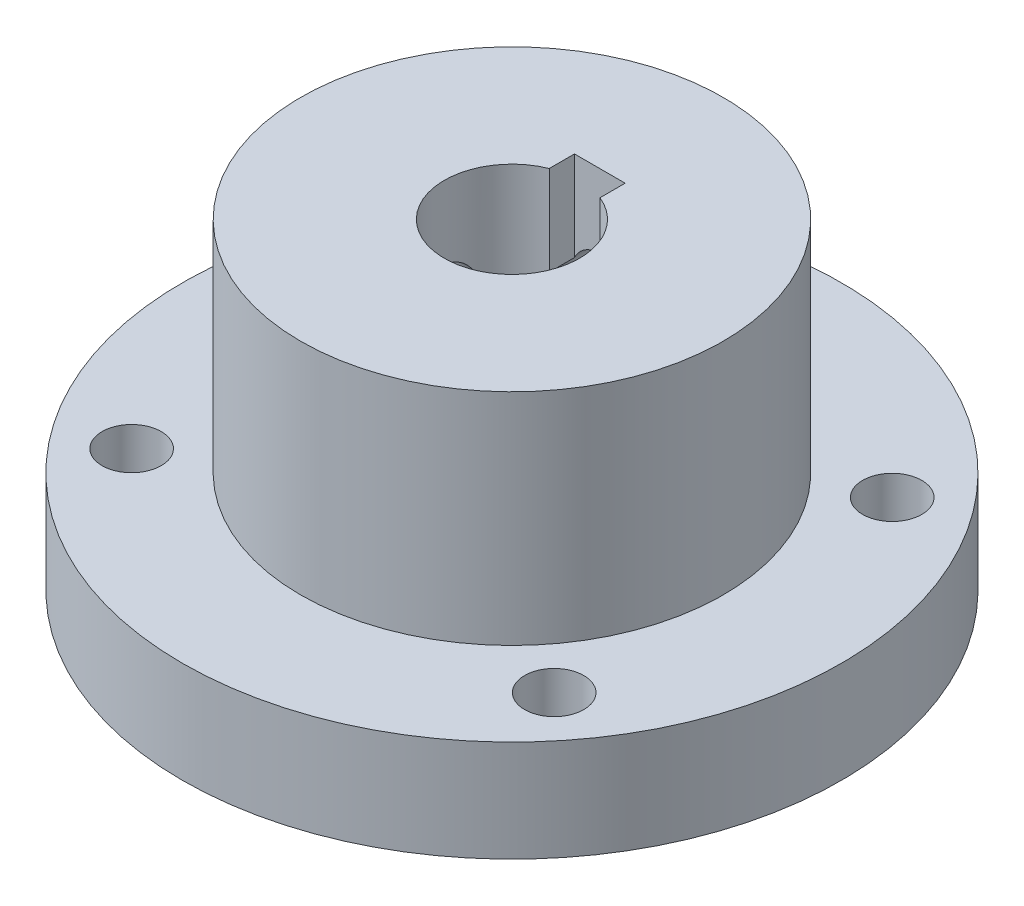
from build123d import *

# Parameters (mm, degrees)
SKETCH1_R           = 4
SKETCH1_R_2         = 1.75
BOSS_EXTRUDE1_DEPTH = 6
SKETCH2_R           = 12.5
SKETCH2_R_2         = 4
BOSS_EXTRUDE2_DEPTH = 13
SKETCH4_W           = 3
SKETCH4_H           = 2.4
CUT_EXTRUDE2_DEPTH  = 30
SKETCH3_R           = 1.65
CUT_EXTRUDE3_DEPTH  = 14
SKETCH5_R           = 1.65
CUT_EXTRUDE4_DEPTH  = 30
BOSS_EXTRUDE3_START = -6
BOSS_EXTRUDE3_DEPTH = 6


with BuildPart() as part:
    # Sketch1 → Boss-Extrude1 (new body)
    with BuildSketch(Plane(origin=(0, 0, 0), x_dir=(1, 0, 0), z_dir=(0, 1, 0))):
        with BuildLine():
            Line((-14.071247279, 13.5), (14.071247279, 13.5))
            ThreePointArc((14.071247279, 13.5), (19.5, 0), (14.071247279, -13.5))
            Line((14.071247279, -13.5), (-14.071247279, -13.5))
            ThreePointArc((-14.071247279, -13.5), (-19.5, 0), (-14.071247279, 13.5))
        make_face()
        with Locations(Location((0, 0, 0), (0, 0, 270))):
            Circle(SKETCH1_R, mode=Mode.SUBTRACT)
        with Locations(Location((-12.5, 10, 0), (0, 0, 270))):
            Circle(SKETCH1_R_2, mode=Mode.SUBTRACT)
        with Locations(Location((-12.5, -10, 0), (0, 0, 270))):
            Circle(SKETCH1_R_2, mode=Mode.SUBTRACT)
        with Locations(Location((12.5, -10, 0), (0, 0, 270))):
            Circle(SKETCH1_R_2, mode=Mode.SUBTRACT)
        with Locations(Location((12.5, 10, 0), (0, 0, 270))):
            Circle(SKETCH1_R_2, mode=Mode.SUBTRACT)
    extrude(amount=BOSS_EXTRUDE1_DEPTH)

    # Sketch2 → Boss-Extrude2 (add)
    with BuildSketch(Plane(origin=(0, 6, 0), x_dir=(1, 0, 0), z_dir=(0, 1, 0))):
        with Locations(Location((0, 0, 0), (0, 0, 90))):
            Circle(SKETCH2_R)
        with Locations(Location((0, 0, 0), (0, 0, 270))):
            Circle(SKETCH2_R_2, mode=Mode.SUBTRACT)
    extrude(amount=BOSS_EXTRUDE2_DEPTH)

    # Sketch4 → Cut-Extrude2 (cut)
    with BuildSketch(Plane(origin=(0, 19, 0), x_dir=(1, 0, 0), z_dir=(0, 1, 0))):
        with Locations((0, 4)):
            Rectangle(SKETCH4_W, SKETCH4_H)
    extrude(amount=-CUT_EXTRUDE2_DEPTH, mode=Mode.SUBTRACT)

    # Sketch3 → Cut-Extrude3 (cut)
    with BuildSketch(Plane(origin=(0, 0, -13.5), x_dir=(-1, 0, 0), z_dir=(0, 0, -1))):
        with Locations(Location((0, 13, 0), (0, 0, 335.380022671))):
            Circle(SKETCH3_R)
    extrude(amount=-CUT_EXTRUDE3_DEPTH, mode=Mode.SUBTRACT)

    # Sketch5 → Cut-Extrude4 (cut)
    with BuildSketch(Plane(origin=(0, 0, 0), x_dir=(0, 0, -1), z_dir=(1, 0, 0))):
        with Locations((0, 13)):
            Circle(SKETCH5_R)
    extrude(amount=-CUT_EXTRUDE4_DEPTH, mode=Mode.SUBTRACT)

    # Sketch6 → Boss-Extrude3 (add)
    with BuildSketch(Plane(origin=(0, 6, 0), x_dir=(1, 0, 0), z_dir=(0, 1, 0)).offset(BOSS_EXTRUDE3_START)):
        with BuildLine():
            Line((-14.071247279, 13.5), (14.071247279, 13.5))
            ThreePointArc((14.071247279, 13.5), (0, 19.5), (-14.071247279, 13.5))
        make_face()
        with BuildLine():
            Line((14.071247279, -13.5), (-14.071247279, -13.5))
            ThreePointArc((-14.071247279, -13.5), (0, -19.5), (14.071247279, -13.5))
        make_face()
    extrude(amount=BOSS_EXTRUDE3_DEPTH)


solid = part.part
